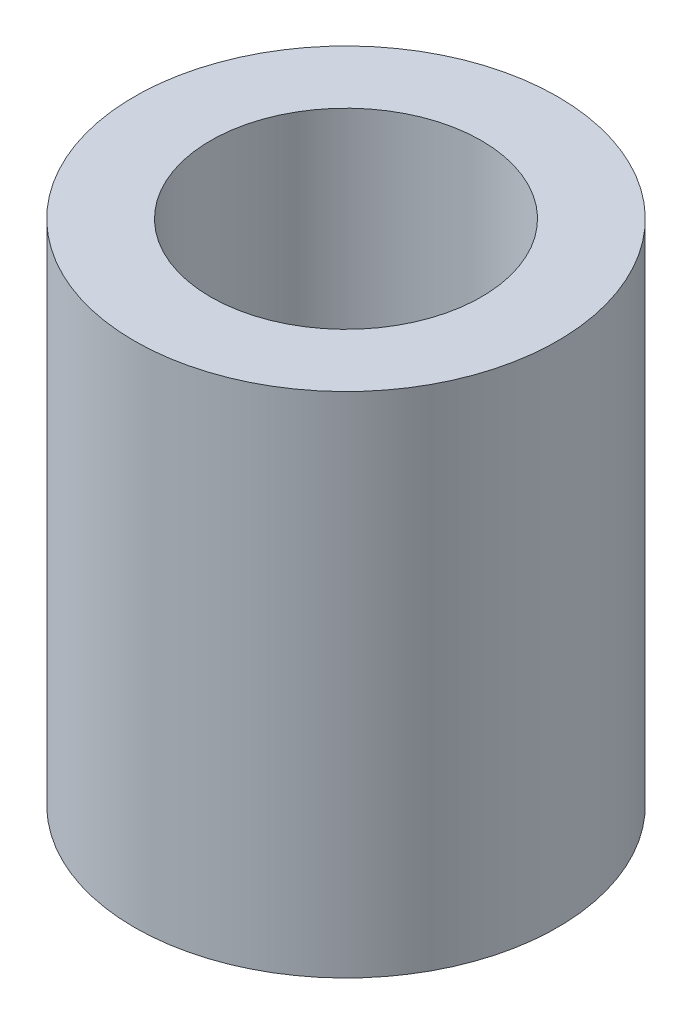
from build123d import *

# Parameters (mm, degrees)
ESBO_O1_R                = 12.5
RESSALTO_EXTRUS_O1_DEPTH = 30
ESBO_O2_R                = 8
CORTE_EXTRUS_O1_DEPTH    = 15
ESBO_O3_W                = 3
ESBO_O3_H                = 5
CORTE_EXTRUS_O2_DEPTH    = 6.5


with BuildPart() as part:
    # Esboço1 → Ressalto-extrusão1 (new body)
    with BuildSketch(Plane(origin=(0, 0, 0), x_dir=(1, 0, 0), z_dir=(0, 1, 0))):
        with Locations(Location((0, 0, 0), (0, 0, 270))):
            Circle(ESBO_O1_R)
    extrude(amount=RESSALTO_EXTRUS_O1_DEPTH)

    # Esboço2 → Corte-extrusão1 (cut)
    with BuildSketch(Plane(origin=(0, 30, 0), x_dir=(1, 0, 0), z_dir=(0, 1, 0))):
        with Locations(Location((0, 0, 0), (0, 0, 270))):
            Circle(ESBO_O2_R)
    extrude(amount=-CORTE_EXTRUS_O1_DEPTH, mode=Mode.SUBTRACT)

    # Esboço3 → Corte-extrusão2 (cut)
    with BuildSketch(Plane.XZ):
        Rectangle(ESBO_O3_W, ESBO_O3_H)
    extrude(amount=-CORTE_EXTRUS_O2_DEPTH, mode=Mode.SUBTRACT)


solid = part.part
